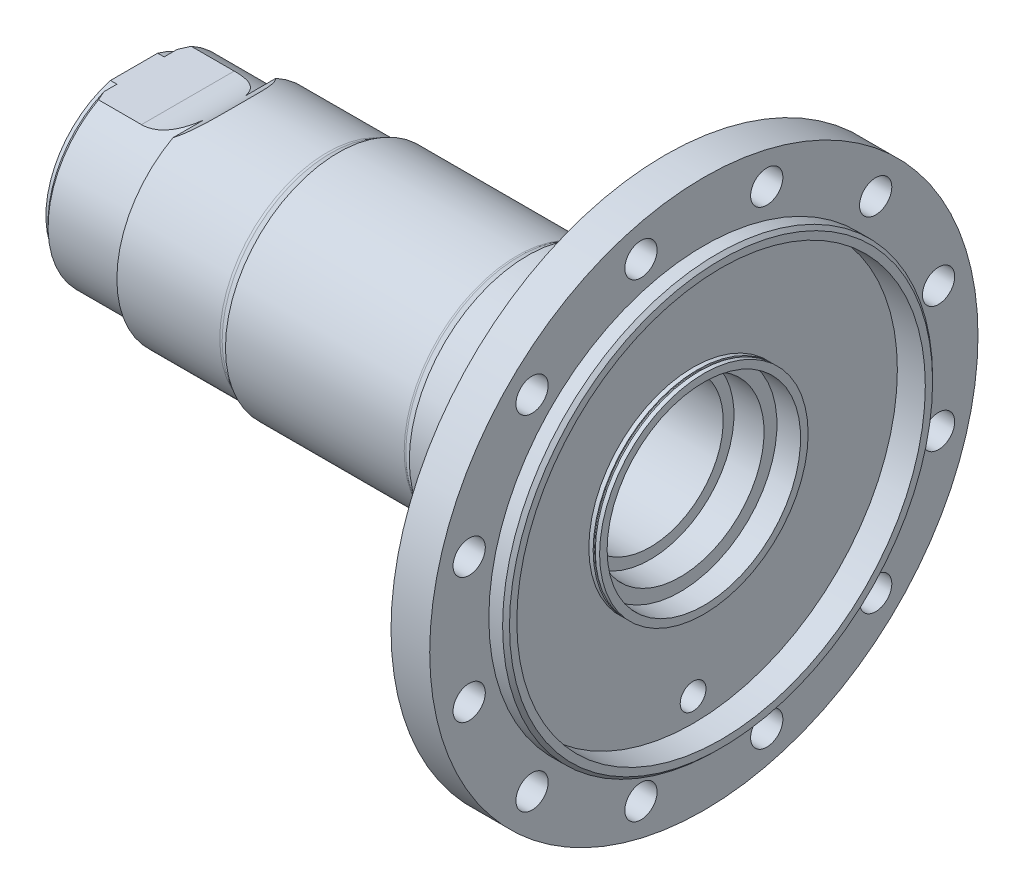
from build123d import *

# Parameters (mm, degrees)
SKETCH_3_W                    = 2
SKETCH_3_H                    = 46.5
SKETCH_5_W                    = 2
SKETCH_5_H                    = 46.5
SKETCH_6_R                    = 7.5
CUT_EXTRUDE_1_DEPTH           = 328.171973127
SKETCH_7_R                    = 7.5
CUT_EXTRUDE_2_DEPTH           = 328.171973127
SKETCH_8_R                    = 7.5
CUT_EXTRUDE_3_DEPTH           = 328.171973127
SKETCH_9_R                    = 7.5
CUT_EXTRUDE_4_DEPTH           = 328.171973127
SKETCH_10_R                   = 7.5
CUT_EXTRUDE_5_DEPTH           = 328.171973127
SKETCH_11_R                   = 7.5
CUT_EXTRUDE_6_DEPTH           = 328.171973127
SKETCH_12_R                   = 7.5
CUT_EXTRUDE_7_DEPTH           = 328.171973127
SKETCH_13_R                   = 7.5
CUT_EXTRUDE_8_DEPTH           = 328.171973127
SKETCH_14_R                   = 7.5
CUT_EXTRUDE_9_DEPTH           = 328.171973127
SKETCH_15_R                   = 7.5
CUT_EXTRUDE_10_DEPTH          = 328.171973127
SKETCH_16_R                   = 7.5
CUT_EXTRUDE_11_DEPTH          = 328.171973127
SKETCH_17_R                   = 7.5
CUT_EXTRUDE_12_DEPTH          = 328.171973127
SKETCH_18_R                   = 6
CUT_EXTRUDE_13_DEPTH          = 328.171973127
LEFT_FLAT_84_5_R35_DEPTH      = 328.171973127
LEFT_FLAT_84_5_R35_DEPTH_BACK = 328.171973127
LEFT_END_BOTTOM_20_DEPTH      = 328.171973127
LEFT_END_BOTTOM_20_DEPTH_BACK = 328.171973127
SKETCH_20_W                   = 4
SKETCH_20_H                   = 75


with BuildPart() as part:
    # Эскиз1 → Повернуть1 (revolve)
    with BuildSketch(Plane.XY, mode=Mode.PRIVATE) as revolve_1_sk:
        with BuildLine():
            Line((0, 0), (273, 0))
            Line((273, 0), (273, 98.4))
            Line((273, 98.4), (271.4, 100))
            Line((271.4, 100), (265, 100))
            Line((265, 100), (265, 127.5))
            Line((265, 127.5), (247, 127.5))
            Line((247, 127.5), (247, 94.828427125))
            ThreePointArc((247, 94.828427125), (246.847759065, 94.06306026), (246.414213562, 93.414213562))
            Line((246.414213562, 93.414213562), (245, 92))
            Line((245, 92), (245, 82.828427125))
            ThreePointArc((245, 82.828427125), (244.847759065, 82.06306026), (244.414213562, 81.414213562))
            Line((244.414213562, 81.414213562), (241, 78))
            Line((241, 78), (241, 68.328427125))
            ThreePointArc((241, 68.328427125), (240.847759065, 67.56306026), (240.414213562, 66.914213562))
            Line((240.414213562, 66.914213562), (239, 65.5))
            Line((239, 65.5), (239, 64.5))
            ThreePointArc((239, 64.5), (238.414213562, 63.085786438), (237, 62.5))
            Line((237, 62.5), (218, 62.5))
            Line((218, 62.5), (215, 60.767949192))
            Line((215, 60.767949192), (215, 57))
            ThreePointArc((215, 57), (214.414213562, 55.585786438), (213, 55))
            Line((213, 55), (183, 55))
            Line((183, 55), (179.133974596, 52.767949192))
            ThreePointArc((179.133974596, 52.767949192), (178.651612686, 52.568148347), (178.133974596, 52.5))
            Line((178.133974596, 52.5), (95, 52.5))
            Line((95, 52.5), (91.366025404, 50.401923789))
            ThreePointArc((91.366025404, 50.401923789), (90.642482539, 50.102222521), (89.866025404, 50))
            Line((89.866025404, 50), (42, 50))
            Line((42, 50), (42, 45))
            Line((42, 45), (5, 45))
            Line((5, 45), (3, 43))
            Line((3, 43), (3, 41))
            Line((3, 41), (0, 41))
            Line((0, 41), (0, 0))
        make_face()
    revolve(revolve_1_sk.sketch.rotate(Axis((0, 0, 0), (1, 0, 0)), 90), axis=Axis((0, 0, 0), (1, 0, 0)))

    # Эскиз2 → Вырез-Повернуть1 (revolve, cut)
    with BuildSketch(Plane.XY, mode=Mode.PRIVATE) as cut_revolve_1_sk:
        Polygon((0, 0), (273, 0), (273, 95), (265, 95), (265, 45), (254, 45), (254, 39), (240, 39), (240, 34), (203.5, 34), (203.5, 31), (3, 31), (0, 32.732050808), align=None)
    revolve(cut_revolve_1_sk.sketch.rotate(Axis((0, 0, 0), (1, 0, 0)), 90), axis=Axis((0, 0, 0), (1, 0, 0)), mode=Mode.SUBTRACT)

    # Эскиз3 → Rear_recess_left (revolve, cut)
    with BuildSketch(Plane.XY, mode=Mode.PRIVATE) as rear_recess_left_sk:
        with Locations((261, 71.75)):
            Rectangle(SKETCH_3_W, SKETCH_3_H)
    revolve(rear_recess_left_sk.sketch.rotate(Axis((0, 0, 0), (1, 0, 0)), 90), axis=Axis((0, 0, 0), (1, 0, 0)), mode=Mode.SUBTRACT)

    # Эскиз4 → Collar_groove_nominal (revolve, cut)
    with BuildSketch(Plane.XY, mode=Mode.PRIVATE) as collar_groove_nominal_sk:
        with BuildLine():
            Line((263, 48), (263, 95))
            Line((263, 95), (262, 95))
            Line((262, 95), (262, 48))
            ThreePointArc((262, 48), (262.146446609, 47.646446609), (262.5, 47.5))
            ThreePointArc((262.5, 47.5), (262.853553391, 47.646446609), (263, 48))
        make_face()
    revolve(collar_groove_nominal_sk.sketch.rotate(Axis((0, 0, 0), (1, 0, 0)), 90), axis=Axis((0, 0, 0), (1, 0, 0)), mode=Mode.SUBTRACT)

    # Эскиз5 → Rear_recess_lip (revolve, cut)
    with BuildSketch(Plane.XY, mode=Mode.PRIVATE) as rear_recess_lip_sk:
        with Locations((264, 71.75)):
            Rectangle(SKETCH_5_W, SKETCH_5_H)
    revolve(rear_recess_lip_sk.sketch.rotate(Axis((0, 0, 0), (1, 0, 0)), 90), axis=Axis((0, 0, 0), (1, 0, 0)), mode=Mode.SUBTRACT)

    # Эскиз6 → Вырез-Вытянуть1 (cut, through all)
    with BuildSketch(Plane(origin=(0, 0, 0), x_dir=(0, 0, -1), z_dir=(1, 0, 0))):
        with Locations(Location((109.149618371, 29.246552097, 0), (0, 0, 180))):
            Circle(SKETCH_6_R)
    extrude(amount=CUT_EXTRUDE_1_DEPTH, mode=Mode.SUBTRACT)

    # Эскиз7 → Вырез-Вытянуть2 (cut, through all)
    with BuildSketch(Plane(origin=(0, 0, 0), x_dir=(0, 0, -1), z_dir=(1, 0, 0))):
        with Locations(Location((79.903066274, 79.903066274, 0), (0, 0, 180))):
            Circle(SKETCH_7_R)
    extrude(amount=CUT_EXTRUDE_2_DEPTH, mode=Mode.SUBTRACT)

    # Эскиз8 → Вырез-Вытянуть3 (cut, through all)
    with BuildSketch(Plane(origin=(0, 0, 0), x_dir=(0, 0, -1), z_dir=(1, 0, 0))):
        with Locations(Location((29.246552097, 109.149618371, 0), (0, 0, 180))):
            Circle(SKETCH_8_R)
    extrude(amount=CUT_EXTRUDE_3_DEPTH, mode=Mode.SUBTRACT)

    # Эскиз9 → Вырез-Вытянуть4 (cut, through all)
    with BuildSketch(Plane(origin=(0, 0, 0), x_dir=(0, 0, -1), z_dir=(1, 0, 0))):
        with Locations(Location((-29.246552097, 109.149618371, 0), (0, 0, 180))):
            Circle(SKETCH_9_R)
    extrude(amount=CUT_EXTRUDE_4_DEPTH, mode=Mode.SUBTRACT)

    # Эскиз10 → Вырез-Вытянуть5 (cut, through all)
    with BuildSketch(Plane(origin=(0, 0, 0), x_dir=(0, 0, -1), z_dir=(1, 0, 0))):
        with Locations(Location((-79.903066274, 79.903066274, 0), (0, 0, 180))):
            Circle(SKETCH_10_R)
    extrude(amount=CUT_EXTRUDE_5_DEPTH, mode=Mode.SUBTRACT)

    # Эскиз11 → Вырез-Вытянуть6 (cut, through all)
    with BuildSketch(Plane(origin=(0, 0, 0), x_dir=(0, 0, -1), z_dir=(1, 0, 0))):
        with Locations(Location((-109.149618371, 29.246552097, 0), (0, 0, 180))):
            Circle(SKETCH_11_R)
    extrude(amount=CUT_EXTRUDE_6_DEPTH, mode=Mode.SUBTRACT)

    # Эскиз12 → Вырез-Вытянуть7 (cut, through all)
    with BuildSketch(Plane(origin=(0, 0, 0), x_dir=(0, 0, -1), z_dir=(1, 0, 0))):
        with Locations(Location((-109.149618371, -29.246552097, 0), (0, 0, 180))):
            Circle(SKETCH_12_R)
    extrude(amount=CUT_EXTRUDE_7_DEPTH, mode=Mode.SUBTRACT)

    # Эскиз13 → Вырез-Вытянуть8 (cut, through all)
    with BuildSketch(Plane(origin=(0, 0, 0), x_dir=(0, 0, -1), z_dir=(1, 0, 0))):
        with Locations(Location((-79.903066274, -79.903066274, 0), (0, 0, 180))):
            Circle(SKETCH_13_R)
    extrude(amount=CUT_EXTRUDE_8_DEPTH, mode=Mode.SUBTRACT)

    # Эскиз14 → Вырез-Вытянуть9 (cut, through all)
    with BuildSketch(Plane(origin=(0, 0, 0), x_dir=(0, 0, -1), z_dir=(1, 0, 0))):
        with Locations(Location((-29.246552097, -109.149618371, 0), (0, 0, 180))):
            Circle(SKETCH_14_R)
    extrude(amount=CUT_EXTRUDE_9_DEPTH, mode=Mode.SUBTRACT)

    # Эскиз15 → Вырез-Вытянуть10 (cut, through all)
    with BuildSketch(Plane(origin=(0, 0, 0), x_dir=(0, 0, -1), z_dir=(1, 0, 0))):
        with Locations(Location((29.246552097, -109.149618371, 0), (0, 0, 180))):
            Circle(SKETCH_15_R)
    extrude(amount=CUT_EXTRUDE_10_DEPTH, mode=Mode.SUBTRACT)

    # Эскиз16 → Вырез-Вытянуть11 (cut, through all)
    with BuildSketch(Plane(origin=(0, 0, 0), x_dir=(0, 0, -1), z_dir=(1, 0, 0))):
        with Locations(Location((79.903066274, -79.903066274, 0), (0, 0, 180))):
            Circle(SKETCH_16_R)
    extrude(amount=CUT_EXTRUDE_11_DEPTH, mode=Mode.SUBTRACT)

    # Эскиз17 → Вырез-Вытянуть12 (cut, through all)
    with BuildSketch(Plane(origin=(0, 0, 0), x_dir=(0, 0, -1), z_dir=(1, 0, 0))):
        with Locations(Location((109.149618371, -29.246552097, 0), (0, 0, 180))):
            Circle(SKETCH_17_R)
    extrude(amount=CUT_EXTRUDE_12_DEPTH, mode=Mode.SUBTRACT)

    # Эскиз18 → Вырез-Вытянуть13 (cut, through all)
    with BuildSketch(Plane(origin=(0, 0, 0), x_dir=(0, 0, -1), z_dir=(1, 0, 0))):
        with Locations(Location((0, -84, 0), (0, 0, 166.725608927))):
            Circle(SKETCH_18_R)
    extrude(amount=CUT_EXTRUDE_13_DEPTH, mode=Mode.SUBTRACT)

    # Эскиз19 → Left_flat_84_5_R35 (cut, two sides: drawn at the far end of the back side and taken through both)
    with BuildSketch(Plane.XY.offset(-LEFT_FLAT_84_5_R35_DEPTH_BACK)):
        with BuildLine():
            Line((-1, 39.5), (25, 39.5))
            ThreePointArc((25, 39.5), (49.748737342, 49.751262658), (60, 74.5))
            Line((60, 74.5), (60, 150))
            Line((60, 150), (-1, 150))
            Line((-1, 150), (-1, 39.5))
        make_face()
    extrude(amount=LEFT_FLAT_84_5_R35_DEPTH + LEFT_FLAT_84_5_R35_DEPTH_BACK, mode=Mode.SUBTRACT)

    # Эскиз20 → Left_end_bottom_20 (cut, two sides: drawn at the far end of the back side and taken through both)
    with BuildSketch(Plane.XY.offset(-LEFT_END_BOTTOM_20_DEPTH_BACK)):
        with Locations((1, -62.5)):
            Rectangle(SKETCH_20_W, SKETCH_20_H)
    extrude(amount=LEFT_END_BOTTOM_20_DEPTH + LEFT_END_BOTTOM_20_DEPTH_BACK, mode=Mode.SUBTRACT)


solid = part.part
